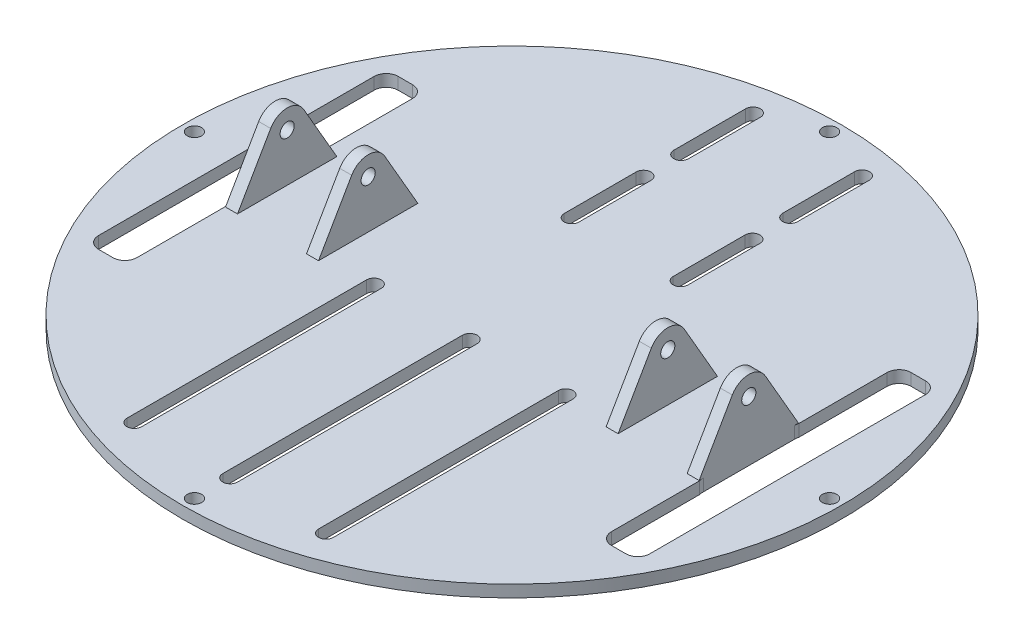
from build123d import *

# Parameters (mm, degrees)
SKETCH1_R           = 69.85
BOSS_EXTRUDE1_DEPTH = 2.54
CUT_EXTRUDE1_DEPTH  = 99.815467413
BOSS_EXTRUDE2_START = 50.192
SKETCH6_R           = 1.500000048
BOSS_EXTRUDE2_DEPTH = 2.54
BOSS_EXTRUDE3_START = -47.652
SKETCH6_2_R         = 1.500000048
BOSS_EXTRUDE3_DEPTH = 2.54
BOSS_EXTRUDE4_START = 33.02
SKETCH6_3_R         = 1.500000048
BOSS_EXTRUDE4_DEPTH = 2.54
BOSS_EXTRUDE5_START = -30.48
SKETCH6_4_R         = 1.500000048
BOSS_EXTRUDE5_DEPTH = 2.54
CUT_EXTRUDE2_DEPTH  = 2.54
SKETCH15_R          = 1.524
CUT_EXTRUDE3_DEPTH  = 101.191180398
CUT_EXTRUDE4_DEPTH  = 100.798221574
CUT_EXTRUDE5_DEPTH  = 100.798221574
CUT_EXTRUDE6_DEPTH  = 100.798221574


with BuildPart() as part:
    # Sketch1 → Boss-Extrude1 (new body)
    with BuildSketch(Plane(origin=(0, 0, 0), x_dir=(1, 0, 0), z_dir=(0, 1, 0))):
        with Locations(Location((0, 0, 0), (0, 0, 270))):
            Circle(SKETCH1_R)
    extrude(amount=BOSS_EXTRUDE1_DEPTH)

    # Sketch4 → Cut-Extrude1 (cut, through all)
    # profile 1 of 4: a face of its own
    with BuildSketch(Plane(origin=(0, 2.54, 0), x_dir=(1, 0, 0), z_dir=(0, 1, 0))):
        with BuildLine():
            Line((-58.208, 9.631888514), (-58.208, -9.631889268))
            add(Edge.make_bspline(
                [(-58.208, -9.631889268), (-58.208015921, -9.985218669), (-58.130777039, -10.689164032), (-57.724991191, -11.716597084), (-56.935897281, -12.599237222), (-56.103541266, -12.868222794), (-55.699980698, -12.868194168)],
                knots=[4.55e-06, 4.55e-06, 4.55e-06, 4.55e-06, 0.250002711, 0.500000873, 0.749999035, 0.999997196, 0.999997196, 0.999997196, 0.999997196], degree=3))
            Line((-55.699980698, -12.868194168), (-52.700019302, -12.868194168))
            add(Edge.make_bspline(
                [(-52.700019302, -12.868194168), (-52.296178776, -12.868222814), (-51.46293258, -12.598414151), (-50.675084586, -11.716743734), (-50.268205425, -10.686485196), (-50.191984113, -9.984638082), (-50.192, -9.631888514)],
                knots=[2.799e-06, 2.799e-06, 2.799e-06, 2.799e-06, 0.250000965, 0.49999913, 0.749997296, 0.999995461, 0.999995461, 0.999995461, 0.999995461], degree=3))
            Line((-50.192, -9.631888514), (-50.192, 9.631889268))
            add(Edge.make_bspline(
                [(-50.192, 9.631889268), (-50.191984079, 9.985218669), (-50.269222961, 10.689164032), (-50.675008809, 11.716597084), (-51.464102719, 12.599237222), (-52.296458734, 12.868222794), (-52.700019302, 12.868194168)],
                knots=[4.55e-06, 4.55e-06, 4.55e-06, 4.55e-06, 0.250002711, 0.500000873, 0.749999035, 0.999997196, 0.999997196, 0.999997196, 0.999997196], degree=3))
            Line((-52.700019302, 12.868194168), (-55.699980698, 12.868194168))
            add(Edge.make_bspline(
                [(-55.699980698, 12.868194168), (-56.103821223, 12.868222814), (-56.937067419, 12.598414151), (-57.724915414, 11.716743735), (-58.131794574, 10.686485196), (-58.208015887, 9.984638082), (-58.208, 9.631888514)],
                knots=[2.799e-06, 2.799e-06, 2.799e-06, 2.799e-06, 0.250000965, 0.49999913, 0.749997296, 0.999995461, 0.999995461, 0.999995461, 0.999995461], degree=3))
        make_face()
        with BuildLine():
            Line((-50.7, -9.631900278), (-50.7, 9.631901038))
            add(Edge.make_bspline(
                [(-52.7, 12.360194168), (-52.660543045, 12.360197394), (-52.581526732, 12.357176393), (-52.458990478, 12.342810716), (-52.339578451, 12.319437383), (-52.22147864, 12.286559843), (-52.105122747, 12.244501481), (-51.990937987, 12.193317687), (-51.879333503, 12.133154033), (-51.673421613, 12.002425371), (-51.392572455, 11.75190052), (-51.108542724, 11.351640508), (-50.898924682, 10.89638005), (-50.777070273, 10.457449832), (-50.714131373, 10.042766184), (-50.69999314, 9.775744558), (-50.7, 9.631901038)],
                knots=[0, 0, 0, 0, 0.032186408, 0.064453943, 0.096880469, 0.129541877, 0.162511195, 0.195857823, 0.229646891, 0.26393876, 0.391040825, 0.527783634, 0.654106325, 0.790546325, 0.891198015, 1, 1, 1, 1], degree=3))
            Line((-52.7, 12.360194168), (-55.7, 12.360194168))
            add(Edge.make_bspline(
                [(-57.7, 9.631900278), (-57.700003497, 9.705266421), (-57.696255035, 9.846713018), (-57.681641642, 10.036669894), (-57.657827677, 10.227708374), (-57.60619141, 10.519368132), (-57.500928131, 10.896361802), (-57.291751816, 11.351113376), (-57.008289301, 11.750754133), (-56.696651354, 12.029288898), (-56.414518772, 12.195927864), (-56.18237574, 12.289823438), (-55.938924091, 12.347916661), (-55.779374994, 12.360200658), (-55.7, 12.360194168)],
                knots=[0, 0, 0, 0, 0.055429119, 0.108848879, 0.16022806, 0.209539049, 0.345987225, 0.472317996, 0.608681282, 0.735454202, 0.803707179, 0.870178354, 0.935409387, 1, 1, 1, 1], degree=3))
            Line((-57.7, 9.631900278), (-57.7, -9.631901038))
            add(Edge.make_bspline(
                [(-55.7, -12.360194168), (-55.739456955, -12.360197394), (-55.818473268, -12.357176393), (-55.941009522, -12.342810716), (-56.060421549, -12.319437383), (-56.17852136, -12.286559843), (-56.294877253, -12.244501481), (-56.409062013, -12.193317687), (-56.520666497, -12.133154033), (-56.726578387, -12.002425371), (-57.007427545, -11.75190052), (-57.291457276, -11.351640508), (-57.501075318, -10.89638005), (-57.622929727, -10.457449832), (-57.685868627, -10.042766184), (-57.70000686, -9.775744558), (-57.7, -9.631901038)],
                knots=[0, 0, 0, 0, 0.032186408, 0.064453943, 0.096880469, 0.129541877, 0.162511195, 0.195857823, 0.229646891, 0.26393876, 0.391040825, 0.527783634, 0.654106325, 0.790546325, 0.891198015, 1, 1, 1, 1], degree=3))
            Line((-55.7, -12.360194168), (-52.7, -12.360194168))
            add(Edge.make_bspline(
                [(-50.7, -9.631900278), (-50.699996503, -9.705266421), (-50.703744965, -9.846713018), (-50.718358358, -10.036669894), (-50.742172323, -10.227708374), (-50.79380859, -10.519368132), (-50.899071869, -10.896361802), (-51.108248184, -11.351113376), (-51.391710699, -11.750754133), (-51.703348646, -12.029288898), (-51.985481228, -12.195927864), (-52.21762426, -12.289823438), (-52.461075909, -12.347916661), (-52.620625006, -12.360200658), (-52.7, -12.360194168)],
                knots=[0, 0, 0, 0, 0.055429119, 0.108848879, 0.16022806, 0.209539049, 0.345987225, 0.472317996, 0.608681282, 0.735454202, 0.803707179, 0.870178354, 0.935409387, 1, 1, 1, 1], degree=3))
        make_face(mode=Mode.SUBTRACT)
    # profile 2 of 4: a face of its own
    with BuildSketch(Plane(origin=(0, 2.54, 0), x_dir=(1, 0, 0), z_dir=(0, 1, 0))):
        with BuildLine():
            add(Edge.make_bspline(
                [(-50.7, -9.631900278), (-50.699996503, -9.705266421), (-50.703744965, -9.846713018), (-50.718358358, -10.036669894), (-50.742172323, -10.227708374), (-50.79380859, -10.519368132), (-50.899071869, -10.896361802), (-51.108248184, -11.351113376), (-51.391710699, -11.750754133), (-51.703348646, -12.029288898), (-51.985481228, -12.195927864), (-52.21762426, -12.289823438), (-52.461075909, -12.347916661), (-52.620625006, -12.360200658), (-52.7, -12.360194168)],
                knots=[0, 0, 0, 0, 0.055429119, 0.108848879, 0.16022806, 0.209539049, 0.345987225, 0.472317996, 0.608681282, 0.735454202, 0.803707179, 0.870178354, 0.935409387, 1, 1, 1, 1], degree=3))
            Line((-52.7, -12.360194168), (-55.7, -12.360194168))
            add(Edge.make_bspline(
                [(-55.7, -12.360194168), (-55.739456955, -12.360197394), (-55.818473268, -12.357176393), (-55.941009522, -12.342810716), (-56.060421549, -12.319437383), (-56.17852136, -12.286559843), (-56.294877253, -12.244501481), (-56.409062013, -12.193317687), (-56.520666497, -12.133154033), (-56.726578387, -12.002425371), (-57.007427545, -11.75190052), (-57.291457276, -11.351640508), (-57.501075318, -10.89638005), (-57.622929727, -10.457449832), (-57.685868627, -10.042766184), (-57.70000686, -9.775744558), (-57.7, -9.631901038)],
                knots=[0, 0, 0, 0, 0.032186408, 0.064453943, 0.096880469, 0.129541877, 0.162511195, 0.195857823, 0.229646891, 0.26393876, 0.391040825, 0.527783634, 0.654106325, 0.790546325, 0.891198015, 1, 1, 1, 1], degree=3))
            Line((-57.7, -9.631901038), (-57.7, 9.631900278))
            add(Edge.make_bspline(
                [(-57.7, 9.631900278), (-57.700003497, 9.705266421), (-57.696255035, 9.846713018), (-57.681641642, 10.036669894), (-57.657827677, 10.227708374), (-57.60619141, 10.519368132), (-57.500928131, 10.896361802), (-57.291751816, 11.351113376), (-57.008289301, 11.750754133), (-56.696651354, 12.029288898), (-56.414518772, 12.195927864), (-56.18237574, 12.289823438), (-55.938924091, 12.347916661), (-55.779374994, 12.360200658), (-55.7, 12.360194168)],
                knots=[0, 0, 0, 0, 0.055429119, 0.108848879, 0.16022806, 0.209539049, 0.345987225, 0.472317996, 0.608681282, 0.735454202, 0.803707179, 0.870178354, 0.935409387, 1, 1, 1, 1], degree=3))
            Line((-55.7, 12.360194168), (-52.7, 12.360194168))
            add(Edge.make_bspline(
                [(-52.7, 12.360194168), (-52.660543045, 12.360197394), (-52.581526732, 12.357176393), (-52.458990478, 12.342810716), (-52.339578451, 12.319437383), (-52.22147864, 12.286559843), (-52.105122747, 12.244501481), (-51.990937987, 12.193317687), (-51.879333503, 12.133154033), (-51.673421613, 12.002425371), (-51.392572455, 11.75190052), (-51.108542724, 11.351640508), (-50.898924682, 10.89638005), (-50.777070273, 10.457449832), (-50.714131373, 10.042766184), (-50.69999314, 9.775744558), (-50.7, 9.631901038)],
                knots=[0, 0, 0, 0, 0.032186408, 0.064453943, 0.096880469, 0.129541877, 0.162511195, 0.195857823, 0.229646891, 0.26393876, 0.391040825, 0.527783634, 0.654106325, 0.790546325, 0.891198015, 1, 1, 1, 1], degree=3))
            Line((-50.7, 9.631901038), (-50.7, -9.631900278))
        make_face()
    # profile 3 of 4: a face of its own
    with BuildSketch(Plane(origin=(0, 2.54, 0), x_dir=(1, 0, 0), z_dir=(0, 1, 0))):
        with BuildLine():
            Line((50.192, 9.631888514), (50.192, -9.631889268))
            add(Edge.make_bspline(
                [(50.192, -9.631889268), (50.191984079, -9.98521867), (50.269222961, -10.689164033), (50.675008809, -11.716597085), (51.464102719, -12.599237222), (52.296458734, -12.868222794), (52.700019302, -12.868194168)],
                knots=[4.55e-06, 4.55e-06, 4.55e-06, 4.55e-06, 0.250002711, 0.500000873, 0.749999035, 0.999997196, 0.999997196, 0.999997196, 0.999997196], degree=3))
            Line((52.700019302, -12.868194168), (55.699980698, -12.868194168))
            add(Edge.make_bspline(
                [(55.699980698, -12.868194168), (56.103821224, -12.868222814), (56.93706742, -12.598414151), (57.724915414, -11.716743734), (58.131794575, -10.686485196), (58.208015887, -9.984638082), (58.208, -9.631888514)],
                knots=[2.799e-06, 2.799e-06, 2.799e-06, 2.799e-06, 0.250000965, 0.49999913, 0.749997296, 0.999995461, 0.999995461, 0.999995461, 0.999995461], degree=3))
            Line((58.208, -9.631888514), (58.208, 9.631889268))
            add(Edge.make_bspline(
                [(58.208, 9.631889268), (58.208015921, 9.985218669), (58.130777039, 10.689164032), (57.724991191, 11.716597084), (56.935897282, 12.599237222), (56.103541267, 12.868222793), (55.699980699, 12.868194168)],
                knots=[4.55e-06, 4.55e-06, 4.55e-06, 4.55e-06, 0.250002711, 0.500000873, 0.749999035, 0.999997196, 0.999997196, 0.999997196, 0.999997196], degree=3))
            Line((55.699980699, 12.868194168), (52.700019301, 12.868194168))
            add(Edge.make_bspline(
                [(52.700019301, 12.868194168), (52.296178775, 12.868222814), (51.46293258, 12.598414151), (50.675084585, 11.716743734), (50.268205425, 10.686485196), (50.191984113, 9.984638082), (50.192, 9.631888514)],
                knots=[2.799e-06, 2.799e-06, 2.799e-06, 2.799e-06, 0.250000965, 0.49999913, 0.749997296, 0.999995461, 0.999995461, 0.999995461, 0.999995461], degree=3))
        make_face()
        with BuildLine():
            Line((57.7, 9.631901038), (57.7, -9.631900278))
            add(Edge.make_bspline(
                [(57.7, -9.631900278), (57.700003497, -9.705266421), (57.696255035, -9.846713018), (57.681641642, -10.036669894), (57.657827677, -10.227708374), (57.60619141, -10.519368132), (57.500928131, -10.896361802), (57.291751816, -11.351113376), (57.008289301, -11.750754133), (56.696651354, -12.029288898), (56.414518772, -12.195927864), (56.18237574, -12.289823438), (55.938924091, -12.347916661), (55.779374994, -12.360200658), (55.7, -12.360194168)],
                knots=[0, 0, 0, 0, 0.055429119, 0.108848879, 0.16022806, 0.209539049, 0.345987225, 0.472317996, 0.608681282, 0.735454202, 0.803707179, 0.870178354, 0.935409387, 1, 1, 1, 1], degree=3))
            Line((55.7, -12.360194168), (52.7, -12.360194168))
            add(Edge.make_bspline(
                [(52.7, -12.360194168), (52.660543045, -12.360197394), (52.581526732, -12.357176393), (52.458990478, -12.342810716), (52.339578451, -12.319437383), (52.22147864, -12.286559843), (52.105122747, -12.244501481), (51.990937987, -12.193317687), (51.879333503, -12.133154033), (51.673421613, -12.002425371), (51.392572455, -11.75190052), (51.108542724, -11.351640508), (50.898924682, -10.89638005), (50.777070273, -10.457449832), (50.714131373, -10.042766184), (50.69999314, -9.775744558), (50.7, -9.631901038)],
                knots=[0, 0, 0, 0, 0.032186408, 0.064453943, 0.096880469, 0.129541877, 0.162511195, 0.195857823, 0.229646891, 0.26393876, 0.391040825, 0.527783634, 0.654106325, 0.790546325, 0.891198015, 1, 1, 1, 1], degree=3))
            Line((50.7, -9.631901038), (50.7, 9.631900278))
            add(Edge.make_bspline(
                [(50.7, 9.631900278), (50.699996503, 9.705266421), (50.703744965, 9.846713018), (50.718358358, 10.036669894), (50.742172323, 10.227708374), (50.79380859, 10.519368132), (50.899071869, 10.896361802), (51.108248184, 11.351113376), (51.391710699, 11.750754133), (51.703348646, 12.029288898), (51.985481228, 12.195927864), (52.21762426, 12.289823438), (52.461075909, 12.347916661), (52.620625006, 12.360200658), (52.7, 12.360194168)],
                knots=[0, 0, 0, 0, 0.055429119, 0.108848879, 0.16022806, 0.209539049, 0.345987225, 0.472317996, 0.608681282, 0.735454202, 0.803707179, 0.870178354, 0.935409387, 1, 1, 1, 1], degree=3))
            Line((52.7, 12.360194168), (55.7, 12.360194168))
            add(Edge.make_bspline(
                [(55.7, 12.360194168), (55.739456955, 12.360197394), (55.818473268, 12.357176393), (55.941009522, 12.342810716), (56.060421549, 12.319437383), (56.17852136, 12.286559843), (56.294877253, 12.244501481), (56.409062013, 12.193317687), (56.520666497, 12.133154033), (56.726578387, 12.002425371), (57.007427545, 11.75190052), (57.291457276, 11.351640508), (57.501075318, 10.89638005), (57.622929727, 10.457449832), (57.685868627, 10.042766184), (57.70000686, 9.775744558), (57.7, 9.631901038)],
                knots=[0, 0, 0, 0, 0.032186408, 0.064453943, 0.096880469, 0.129541877, 0.162511195, 0.195857823, 0.229646891, 0.26393876, 0.391040825, 0.527783634, 0.654106325, 0.790546325, 0.891198015, 1, 1, 1, 1], degree=3))
        make_face(mode=Mode.SUBTRACT)
    # profile 4 of 4: a face of its own
    with BuildSketch(Plane(origin=(0, 2.54, 0), x_dir=(1, 0, 0), z_dir=(0, 1, 0))):
        with BuildLine():
            add(Edge.make_bspline(
                [(57.7, -9.631900278), (57.700003497, -9.705266421), (57.696255035, -9.846713018), (57.681641642, -10.036669894), (57.657827677, -10.227708374), (57.60619141, -10.519368132), (57.500928131, -10.896361802), (57.291751816, -11.351113376), (57.008289301, -11.750754133), (56.696651354, -12.029288898), (56.414518772, -12.195927864), (56.18237574, -12.289823438), (55.938924091, -12.347916661), (55.779374994, -12.360200658), (55.7, -12.360194168)],
                knots=[0, 0, 0, 0, 0.055429119, 0.108848879, 0.16022806, 0.209539049, 0.345987225, 0.472317996, 0.608681282, 0.735454202, 0.803707179, 0.870178354, 0.935409387, 1, 1, 1, 1], degree=3))
            Line((55.7, -12.360194168), (52.7, -12.360194168))
            add(Edge.make_bspline(
                [(52.7, -12.360194168), (52.660543045, -12.360197394), (52.581526732, -12.357176393), (52.458990478, -12.342810716), (52.339578451, -12.319437383), (52.22147864, -12.286559843), (52.105122747, -12.244501481), (51.990937987, -12.193317687), (51.879333503, -12.133154033), (51.673421613, -12.002425371), (51.392572455, -11.75190052), (51.108542724, -11.351640508), (50.898924682, -10.89638005), (50.777070273, -10.457449832), (50.714131373, -10.042766184), (50.69999314, -9.775744558), (50.7, -9.631901038)],
                knots=[0, 0, 0, 0, 0.032186408, 0.064453943, 0.096880469, 0.129541877, 0.162511195, 0.195857823, 0.229646891, 0.26393876, 0.391040825, 0.527783634, 0.654106325, 0.790546325, 0.891198015, 1, 1, 1, 1], degree=3))
            Line((50.7, -9.631901038), (50.7, 9.631900278))
            add(Edge.make_bspline(
                [(50.7, 9.631900278), (50.699996503, 9.705266421), (50.703744965, 9.846713018), (50.718358358, 10.036669894), (50.742172323, 10.227708374), (50.79380859, 10.519368132), (50.899071869, 10.896361802), (51.108248184, 11.351113376), (51.391710699, 11.750754133), (51.703348646, 12.029288898), (51.985481228, 12.195927864), (52.21762426, 12.289823438), (52.461075909, 12.347916661), (52.620625006, 12.360200658), (52.7, 12.360194168)],
                knots=[0, 0, 0, 0, 0.055429119, 0.108848879, 0.16022806, 0.209539049, 0.345987225, 0.472317996, 0.608681282, 0.735454202, 0.803707179, 0.870178354, 0.935409387, 1, 1, 1, 1], degree=3))
            Line((52.7, 12.360194168), (55.7, 12.360194168))
            add(Edge.make_bspline(
                [(55.7, 12.360194168), (55.739456955, 12.360197394), (55.818473268, 12.357176393), (55.941009522, 12.342810716), (56.060421549, 12.319437383), (56.17852136, 12.286559843), (56.294877253, 12.244501481), (56.409062013, 12.193317687), (56.520666497, 12.133154033), (56.726578387, 12.002425371), (57.007427545, 11.75190052), (57.291457276, 11.351640508), (57.501075318, 10.89638005), (57.622929727, 10.457449832), (57.685868627, 10.042766184), (57.70000686, 9.775744558), (57.7, 9.631901038)],
                knots=[0, 0, 0, 0, 0.032186408, 0.064453943, 0.096880469, 0.129541877, 0.162511195, 0.195857823, 0.229646891, 0.26393876, 0.391040825, 0.527783634, 0.654106325, 0.790546325, 0.891198015, 1, 1, 1, 1], degree=3))
            Line((57.7, 9.631901038), (57.7, -9.631900278))
        make_face()
    extrude(amount=-CUT_EXTRUDE1_DEPTH, mode=Mode.SUBTRACT)

    # Sketch6 → Boss-Extrude2 (add)
    with BuildSketch(Plane(origin=(0, 0, 0), x_dir=(0, 0, -1), z_dir=(1, 0, 0)).offset(BOSS_EXTRUDE2_START)):
        with BuildLine():
            Line((3.498742673, 14.720000024), (10.530868965, 2.54))
            Line((10.530868965, 2.54), (-10.530868965, 2.54))
            Line((-10.530868965, 2.54), (-3.498742673, 14.720000024))
            ThreePointArc((-3.498742673, 14.720000024), (0, 16.740000048), (3.498742673, 14.720000024))
        make_face()
        with Locations(Location((0, 12.7, 0), (0, 0, 180))):
            Circle(SKETCH6_R, mode=Mode.SUBTRACT)
    extrude(amount=-BOSS_EXTRUDE2_DEPTH)

    # Sketch6<2> → Boss-Extrude3 (add)
    with BuildSketch(Plane(origin=(0, 0, 0), x_dir=(0, 0, -1), z_dir=(1, 0, 0)).offset(BOSS_EXTRUDE3_START)):
        with BuildLine():
            Line((3.498742673, 14.720000024), (10.530868965, 2.54))
            Line((10.530868965, 2.54), (-10.530868965, 2.54))
            Line((-10.530868965, 2.54), (-3.498742673, 14.720000024))
            ThreePointArc((-3.498742673, 14.720000024), (0, 16.740000048), (3.498742673, 14.720000024))
        make_face()
        with Locations(Location((0, 12.7, 0), (0, 0, 180))):
            Circle(SKETCH6_2_R, mode=Mode.SUBTRACT)
    extrude(amount=-BOSS_EXTRUDE3_DEPTH)

    # Sketch6<3> → Boss-Extrude4 (add)
    with BuildSketch(Plane(origin=(0, 0, 0), x_dir=(0, 0, -1), z_dir=(1, 0, 0)).offset(BOSS_EXTRUDE4_START)):
        with BuildLine():
            Line((3.498742673, 14.720000024), (10.530868965, 2.54))
            Line((10.530868965, 2.54), (-10.530868965, 2.54))
            Line((-10.530868965, 2.54), (-3.498742673, 14.720000024))
            ThreePointArc((-3.498742673, 14.720000024), (0, 16.740000048), (3.498742673, 14.720000024))
        make_face()
        with Locations(Location((0, 12.7, 0), (0, 0, 180))):
            Circle(SKETCH6_3_R, mode=Mode.SUBTRACT)
    extrude(amount=-BOSS_EXTRUDE4_DEPTH)

    # Sketch6<4> → Boss-Extrude5 (add)
    with BuildSketch(Plane(origin=(0, 0, 0), x_dir=(0, 0, -1), z_dir=(1, 0, 0)).offset(BOSS_EXTRUDE5_START)):
        with BuildLine():
            Line((3.498742673, 14.720000024), (10.530868965, 2.54))
            Line((10.530868965, 2.54), (-10.530868965, 2.54))
            Line((-10.530868965, 2.54), (-3.498742673, 14.720000024))
            ThreePointArc((-3.498742673, 14.720000024), (0, 16.740000048), (3.498742673, 14.720000024))
        make_face()
        with Locations(Location((0, 12.7, 0), (0, 0, 180))):
            Circle(SKETCH6_4_R, mode=Mode.SUBTRACT)
    extrude(amount=-BOSS_EXTRUDE5_DEPTH)

    # Sketch8 → Cut-Extrude2 (cut)
    with BuildSketch(Plane(origin=(0, 2.54, 0), x_dir=(1, 0, 0), z_dir=(0, 1, 0))):
        with BuildLine():
            Line((-55.88, -31.75), (-52.832, -31.75))
            ThreePointArc((-52.832, -31.75), (-51.035948776, -31.006051224), (-50.292, -29.21))
            Line((-50.292, -29.21), (-50.292, 29.21))
            ThreePointArc((-50.292, 29.21), (-51.035948776, 31.006051224), (-52.832, 31.75))
            Line((-52.832, 31.75), (-55.88, 31.75))
            ThreePointArc((-55.88, 31.75), (-57.676051224, 31.006051224), (-58.42, 29.21))
            Line((-58.42, 29.21), (-58.42, -29.21))
            ThreePointArc((-58.42, -29.21), (-57.676051224, -31.006051224), (-55.88, -31.75))
        make_face()
        with BuildLine():
            Line((50.292, -29.21), (50.292, 29.21))
            ThreePointArc((50.292, 29.21), (51.035948776, 31.006051224), (52.832, 31.75))
            Line((52.832, 31.75), (55.88, 31.75))
            ThreePointArc((55.88, 31.75), (57.676051224, 31.006051224), (58.42, 29.21))
            Line((58.42, 29.21), (58.42, -29.21))
            ThreePointArc((58.42, -29.21), (57.676051224, -31.006051224), (55.88, -31.75))
            Line((55.88, -31.75), (52.832, -31.75))
            ThreePointArc((52.832, -31.75), (51.035948776, -31.006051224), (50.292, -29.21))
        make_face()
    extrude(amount=-CUT_EXTRUDE2_DEPTH, mode=Mode.SUBTRACT)

    # Sketch15 → Cut-Extrude3 (cut, through all)
    with BuildSketch(Plane.XZ):
        with Locations(Location((67.31, 0, 0), (0, 0, 270))):
            Circle(SKETCH15_R)
        with Locations(Location((0, -67.31, 0), (0, 0, 270))):
            Circle(SKETCH15_R)
        with Locations(Location((-67.31, 0, 0), (0, 0, 270))):
            Circle(SKETCH15_R)
        with Locations(Location((0, 67.31, 0), (0, 0, 270))):
            Circle(SKETCH15_R)
    extrude(amount=-CUT_EXTRUDE3_DEPTH, mode=Mode.SUBTRACT)

    # Sketch16 → Cut-Extrude4 (cut, through all)
    with BuildSketch(Plane(origin=(0, 2.54, 0), x_dir=(1, 0, 0), z_dir=(0, 1, 0))):
        with BuildLine():
            Line((9.989857038, 24.1825), (9.989857038, 39.4225))
            ThreePointArc((9.989857038, 39.4225), (11.552357038, 40.985), (13.114857038, 39.4225))
            Line((13.114857038, 39.4225), (13.114857038, 24.1825))
            ThreePointArc((13.114857038, 24.1825), (11.552357038, 22.62), (9.989857038, 24.1825))
        make_face()
        with BuildLine():
            Line((9.989857038, 47.402118927), (9.989857038, 62.642118927))
            ThreePointArc((9.989857038, 62.642118927), (11.552357038, 64.204618927), (13.114857038, 62.642118927))
            Line((13.114857038, 62.642118927), (13.114857038, 47.402118927))
            ThreePointArc((13.114857038, 47.402118927), (11.552357038, 45.839618927), (9.989857038, 47.402118927))
        make_face()
        with BuildLine():
            Line((-13.114857038, 47.402118927), (-13.114857038, 62.642118927))
            ThreePointArc((-13.114857038, 62.642118927), (-11.552357038, 64.204618927), (-9.989857038, 62.642118927))
            Line((-9.989857038, 62.642118927), (-9.989857038, 47.402118927))
            ThreePointArc((-9.989857038, 47.402118927), (-11.552357038, 45.839618927), (-13.114857038, 47.402118927))
        make_face()
        with BuildLine():
            Line((-9.989857038, 24.1825), (-9.989857038, 39.4225))
            ThreePointArc((-9.989857038, 39.4225), (-11.552357038, 40.985), (-13.114857038, 39.4225))
            Line((-13.114857038, 39.4225), (-13.114857038, 24.1825))
            ThreePointArc((-13.114857038, 24.1825), (-11.552357038, 22.62), (-9.989857038, 24.1825))
        make_face()
    extrude(amount=-CUT_EXTRUDE4_DEPTH, mode=Mode.SUBTRACT)

    # Sketch17 → Cut-Extrude5 (cut, through all)
    with BuildSketch(Plane(origin=(0, 2.54, 0), x_dir=(1, 0, 0), z_dir=(0, 1, 0))):
        with BuildLine():
            Line((18.7575, -8.9425), (18.7575, -59.7425))
            ThreePointArc((18.7575, -59.7425), (20.32, -61.305), (21.8825, -59.7425))
            Line((21.8825, -59.7425), (21.8825, -8.9425))
            ThreePointArc((21.8825, -8.9425), (20.32, -7.38), (18.7575, -8.9425))
        make_face()
    cut_extrude5 = extrude(amount=-CUT_EXTRUDE5_DEPTH, mode=Mode.SUBTRACT)

    # Mirror2: Cut-Extrude5 across plane
    add(cut_extrude5.mirror(Plane(origin=(0, 0, 0), x_dir=(0, 0, 1), z_dir=(1, 0, 0))), mode=Mode.SUBTRACT)

    # Sketch17<3> → Cut-Extrude6 (cut, through all)
    with BuildSketch(Plane(origin=(0, 2.54, 0), x_dir=(1, 0, 0), z_dir=(0, 1, 0))):
        with BuildLine():
            Line((-1.5625, -8.9425), (-1.5625, -59.7425))
            ThreePointArc((-1.5625, -59.7425), (0, -61.305), (1.5625, -59.7425))
            Line((1.5625, -59.7425), (1.5625, -8.9425))
            ThreePointArc((1.5625, -8.9425), (0, -7.38), (-1.5625, -8.9425))
        make_face()
    extrude(amount=-CUT_EXTRUDE6_DEPTH, mode=Mode.SUBTRACT)


solid = part.part
